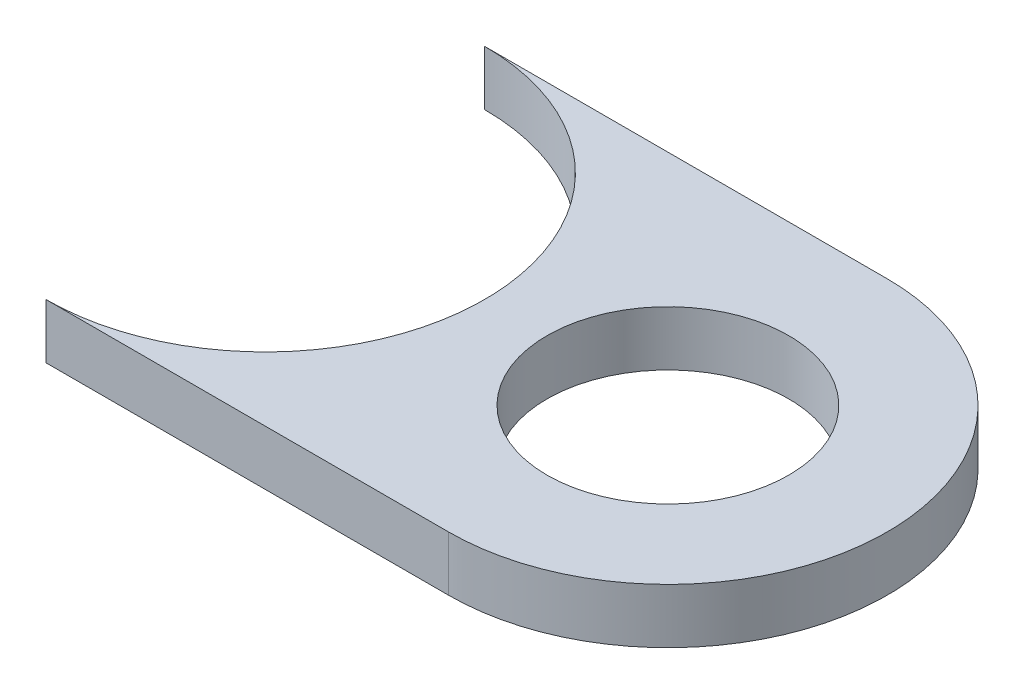
from build123d import *

# Parameters (mm, degrees)
SKETCH1_R           = 7.00024
BOSS_EXTRUDE1_DEPTH = 3.175


with BuildPart() as part:
    # Sketch1 → Boss-Extrude1 (new body)
    with BuildSketch(Plane(origin=(0, 0, 0), x_dir=(1, 0, 0), z_dir=(0, 1, 0))):
        with BuildLine():
            Line((-23.3172, 12.7), (0, 12.7))
            ThreePointArc((0, 12.7), (12.7, 0), (0, -12.7))
            Line((0, -12.7), (-23.3172, -12.7))
            ThreePointArc((-23.3172, -12.7), (-10.6172, 0), (-23.3172, 12.7))
        make_face()
        with Locations(Location((0, 0, 0), (0, 0, 270))):
            Circle(SKETCH1_R, mode=Mode.SUBTRACT)
    extrude(amount=BOSS_EXTRUDE1_DEPTH)


solid = part.part
